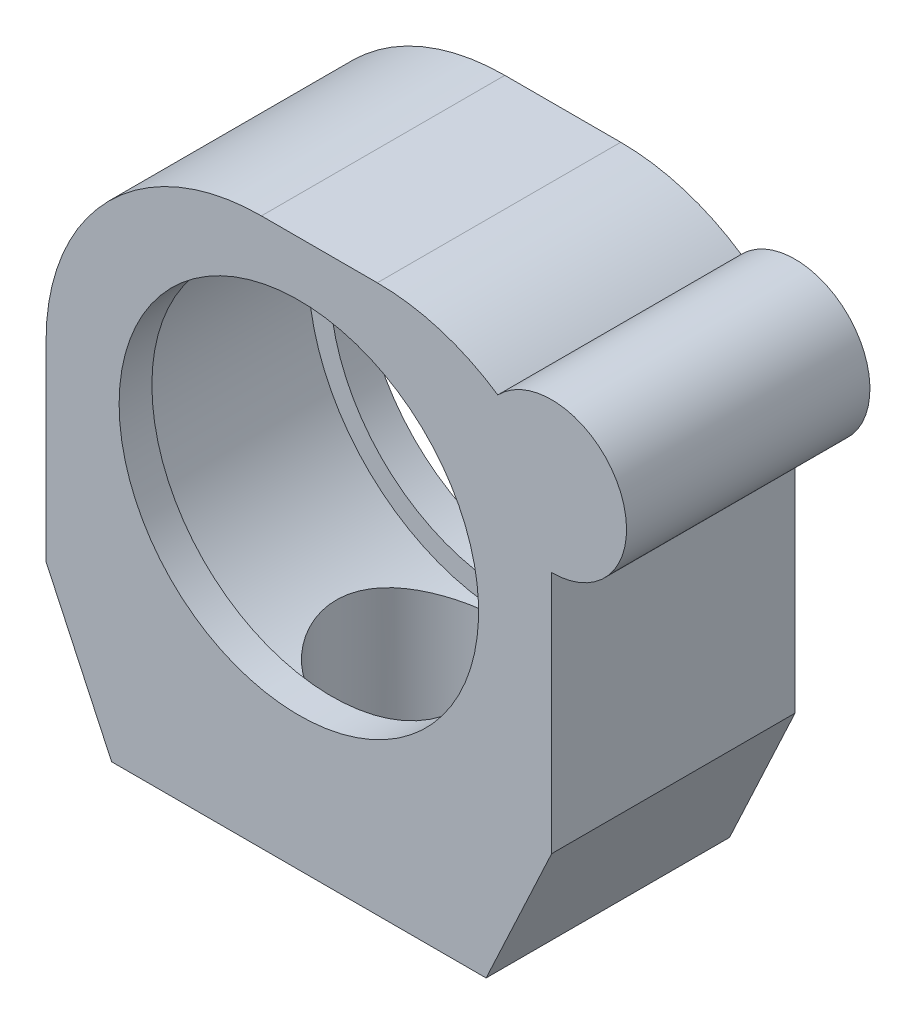
from build123d import *

# Parameters (mm, degrees)
BOSS_EXTRUDE1_DEPTH          = 13
CUT_EXTRUDE1_DEPTH           = 9.5
CUT_EXTRUDE1_DEPTH_BACK      = 9.5
SKETCH2_R                    = 21.5
CUT_EXTRUDE2_REACH           = 71.399
CUT_EXTRUDE2_END_RADIUS      = 21.5
SKETCH3_R                    = 9
F_6_0_6_DIAMETER_HOLE1_D     = 6
F_6_0_6_DIAMETER_HOLE1_DEPTH = 10
F_6_0_6_DIAMETER_HOLE1_TIP   = 1.802581857


with BuildPart() as part:
    # Sketch1 → Boss-Extrude1 (new, symmetric)
    with BuildSketch(Plane(origin=(0, 0, 0), x_dir=(-1, 0, 0), z_dir=(0, 0, -1))):
        with BuildLine():
            Line((-27, 7.5), (-27, -18.5))
            Line((-27, -18.5), (-20, -33.5))
            Line((-20, -33.5), (20, -33.5))
            Line((20, -33.5), (27, -18.5))
            Line((27, -18.5), (27, -15.5))
            Line((27, -15.5), (27, 2))
            ThreePointArc((27, 2), (20.263455967, 18.263455967), (4, 25))
            Line((4, 25), (-8.37877555, 25))
            ThreePointArc((-8.37877555, 25), (-15.10867012, 23.993374436), (-21.249479132, 21.061610355))
            ThreePointArc((-21.249479132, 21.061610355), (-34.365218355, 18.623068776), (-27, 7.5))
        make_face()
        with BuildLine():
            ThreePointArc((-16.651259459, 9.559056356), (-9.559056356, -16.651259459), (16.651259459, -9.559056356))
            ThreePointArc((16.651259459, -9.559056356), (9.559056356, 16.651259459), (-16.651259459, 9.559056356))
        make_face(mode=Mode.SUBTRACT)
    extrude(amount=BOSS_EXTRUDE1_DEPTH, both=True)

    # Sketch2 → Cut-Extrude1 (cut, two sides: drawn at the far end of the back side and taken through both)
    with BuildSketch(Plane.XY.offset(-CUT_EXTRUDE1_DEPTH_BACK)):
        Circle(SKETCH2_R)
    extrude(amount=CUT_EXTRUDE1_DEPTH + CUT_EXTRUDE1_DEPTH_BACK, mode=Mode.SUBTRACT)

    # Cut-Extrude2: up to this cylinder (the profile starts outside it)
    cut_extrude2_end = Plane(origin=(0, 0, 0), z_dir=(0, 0, -1)) * Cylinder(CUT_EXTRUDE2_END_RADIUS, 186.798, mode=Mode.PRIVATE)
    # Sketch3 → Cut-Extrude2 (cut, up to the surface)
    with BuildSketch(Plane.XZ.offset(33.5), mode=Mode.PRIVATE) as cut_extrude2_sk1:
        with Locations(Location((0, 0, 0), (0, 0, 270))):
            Circle(SKETCH3_R)
    cut_extrude2_tool1 = extrude(cut_extrude2_sk1.sketch, amount=-CUT_EXTRUDE2_REACH, mode=Mode.PRIVATE) - cut_extrude2_end
    add(cut_extrude2_tool1.solids().sort_by_distance((0, -33.5, 0))[0], mode=Mode.SUBTRACT)

    # Ø6.0 (6) Diameter Hole1
    with Locations(Plane(origin=(0, -33.5, 0), x_dir=(-1, 0, 0), z_dir=(0, -1, 0))):
        with Locations((-15, 0), (15, 0)):
            Hole(F_6_0_6_DIAMETER_HOLE1_D / 2, depth=F_6_0_6_DIAMETER_HOLE1_DEPTH)
            with Locations((0, 0, -(F_6_0_6_DIAMETER_HOLE1_DEPTH + F_6_0_6_DIAMETER_HOLE1_TIP / 2))):  # 118° drill point
                Cone(0, F_6_0_6_DIAMETER_HOLE1_D / 2, F_6_0_6_DIAMETER_HOLE1_TIP, mode=Mode.SUBTRACT)


solid = part.part
